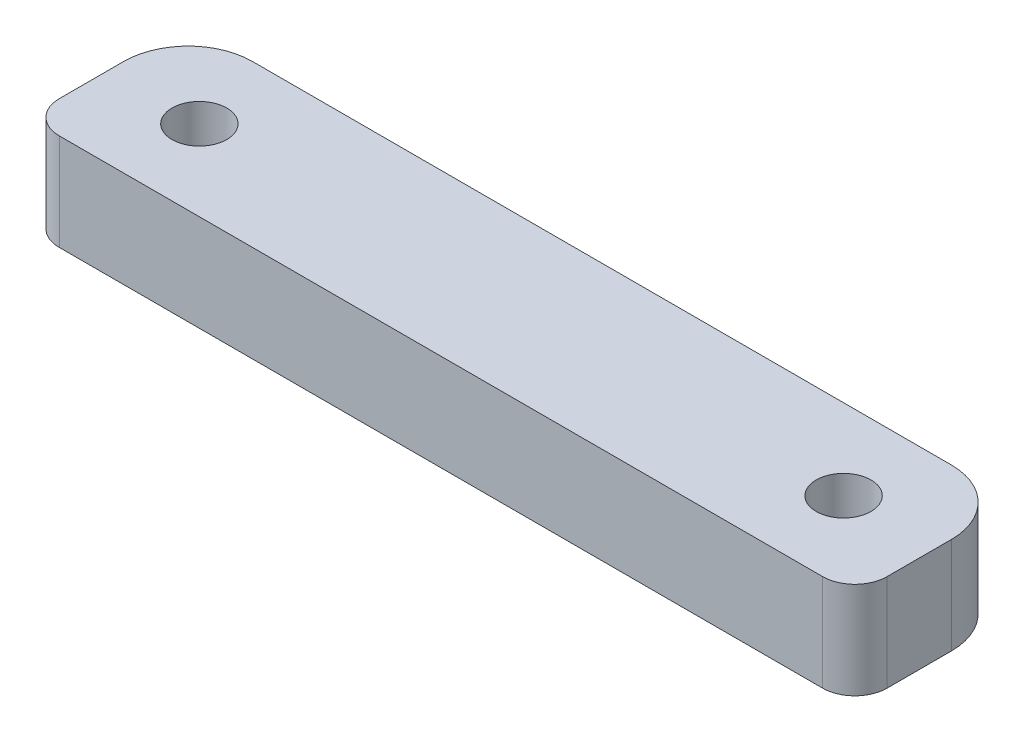
from build123d import *

# Parameters (mm, degrees)
SKETCH1_W           = 51.4
SKETCH1_H           = 10
SKETCH1_R           = 1.7
BOSS_EXTRUDE2_DEPTH = 6
SKETCH1_4_W         = 5.3
SKETCH1_4_H         = 7.2
CUT_EXTRUDE1_DEPTH  = 3.8
FILLET2_R           = 4
FILLET3_R           = 2


with BuildPart() as part:
    # Sketch1 → Boss-Extrude2 (new body)
    with BuildSketch(Plane(origin=(0, 0, 0), x_dir=(1, 0, 0), z_dir=(0, 1, 0))):
        Rectangle(SKETCH1_W, SKETCH1_H)
        with Locations((-20, 0)):
            Circle(SKETCH1_R, mode=Mode.SUBTRACT)
        with Locations((20, 0)):
            Circle(SKETCH1_R, mode=Mode.SUBTRACT)
    extrude(amount=BOSS_EXTRUDE2_DEPTH)

    # Sketch1<4> → Cut-Extrude1 (cut)
    with BuildSketch(Plane(origin=(0, 0, 0), x_dir=(1, 0, 0), z_dir=(0, 1, 0))):
        with Locations((0, 1.4)):
            Rectangle(SKETCH1_4_W, SKETCH1_4_H)
    extrude(amount=CUT_EXTRUDE1_DEPTH, mode=Mode.SUBTRACT)

    # Fillet2
    fillet2_edges = [part.edges().sort_by_distance(p)[0] for p in [
        (25.7, 3, -5),
        (-25.7, 3, -5),
    ]]
    fillet(fillet2_edges, radius=FILLET2_R)

    # Fillet3
    fillet3_edges = [part.edges().sort_by_distance(p)[0] for p in [
        (25.7, 3, 5),
        (-25.7, 3, 5),
    ]]
    fillet(fillet3_edges, radius=FILLET3_R)


solid = part.part
